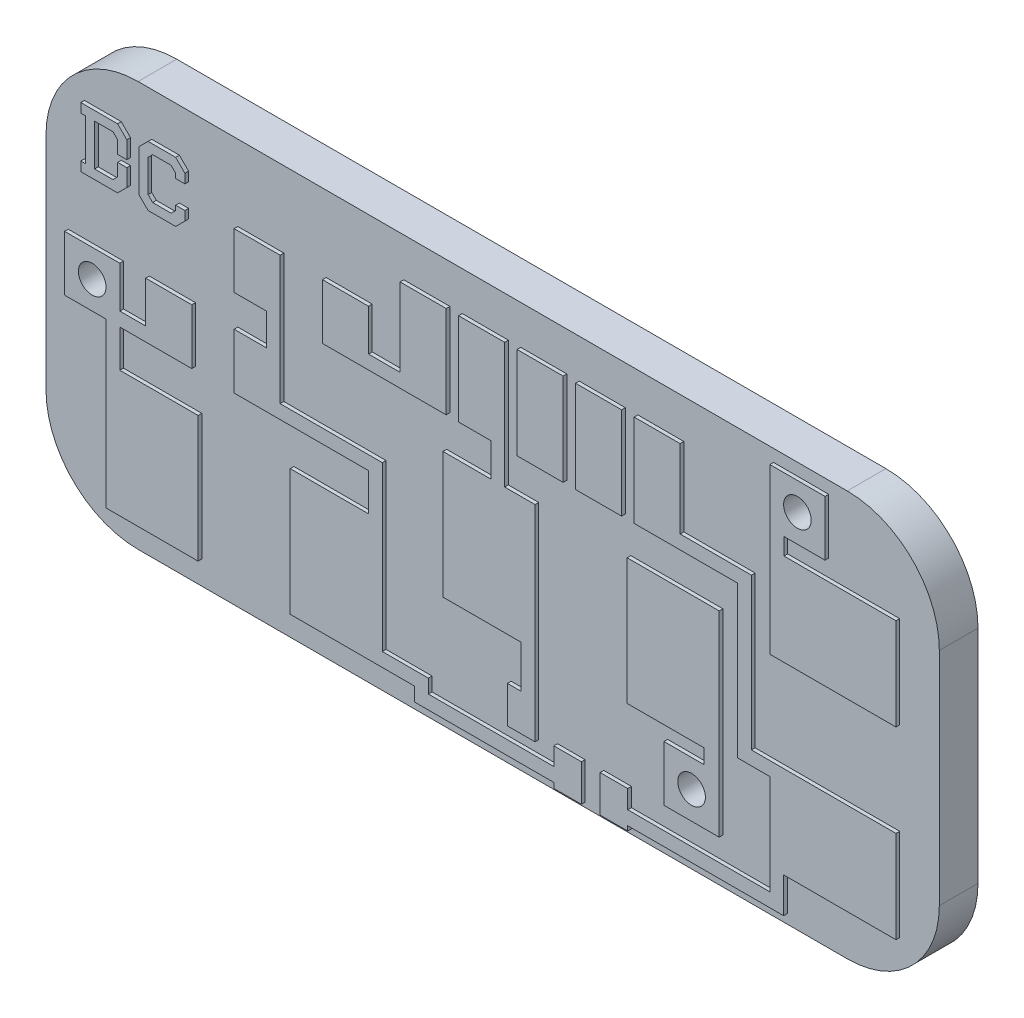
from build123d import *

# Parameters (mm, degrees)
SKETCH1_W            = 9.7
SKETCH1_H            = 4.4
BOSS_EXTRUDE1_DEPTH  = 0.42
FILLET1_R            = 1
FILLET2_R            = 1
FILLET3_R            = 1
FILLET4_R            = 1
BOSS_EXTRUDE2_DEPTH  = 0.04
BOSS_EXTRUDE3_DEPTH  = 0.04
BOSS_EXTRUDE4_DEPTH  = 0.04
BOSS_EXTRUDE5_DEPTH  = 0.04
BOSS_EXTRUDE6_DEPTH  = 0.04
BOSS_EXTRUDE7_DEPTH  = 0.04
BOSS_EXTRUDE8_DEPTH  = 0.04
BOSS_EXTRUDE9_DEPTH  = 0.04
BOSS_EXTRUDE10_DEPTH = 0.04
SKETCH11_W           = 0.5
SKETCH11_H           = 1
BOSS_EXTRUDE11_DEPTH = 0.04
SKETCH12_W           = 0.5
SKETCH12_H           = 1
BOSS_EXTRUDE12_DEPTH = 0.04
BOSS_EXTRUDE13_DEPTH = 0.025
HOLE1_D              = 0.3
HOLE2_D              = 0.3
HOLE3_D              = 0.3
CHAMFER1_SIZE        = 0.1
CHAMFER2_SIZE        = 0.05
CHAMFER3_SIZE        = 0.1
CHAMFER4_SIZE        = 0.05
CHAMFER5_SIZE        = 0.1
CHAMFER6_SIZE        = 0.1
CHAMFER7_SIZE        = 0.05
CHAMFER8_SIZE        = 0.05


with BuildPart() as part:
    # Sketch1 → Boss-Extrude1 (new body)
    with BuildSketch(Plane.XY):
        with Locations((4.849999999, 2.20000002)):
            Rectangle(SKETCH1_W, SKETCH1_H)
    extrude(amount=-BOSS_EXTRUDE1_DEPTH)

    # Fillet1
    fillet1_edges = [part.edges().sort_by_distance(p)[0] for p in [
        (-1e-09, 2e-08, -0.21),
    ]]
    fillet(fillet1_edges, radius=FILLET1_R)

    # Fillet2
    fillet2_edges = [part.edges().sort_by_distance(p)[0] for p in [
        (-1e-09, 4.40000002, -0.21),
    ]]
    fillet(fillet2_edges, radius=FILLET2_R)

    # Fillet3
    fillet3_edges = [part.edges().sort_by_distance(p)[0] for p in [
        (9.699999999, 2e-08, -0.21),
    ]]
    fillet(fillet3_edges, radius=FILLET3_R)

    # Fillet4
    fillet4_edges = [part.edges().sort_by_distance(p)[0] for p in [
        (9.699999999, 4.40000002, -0.21),
    ]]
    fillet(fillet4_edges, radius=FILLET4_R)

    # Sketch2 → Boss-Extrude2 (add)
    with BuildSketch(Plane.XY):
        Polygon((3.691646515, 0.405675456), (4.19162877, 0.405675456), (4.19162877, 0.255675455), (5.553515055, 0.255675455), (5.553515055, 0.45000002), (5.853515055, 0.45000002), (5.853515055, 0.05000002), (5.553515055, 0.05000002), (5.553515055, 0.105675455), (4.04162877, 0.105675455), (4.04162877, 0.255675455), (2.69162877, 0.255675455), (2.69162877, 1.625675455), (3.54162877, 1.625675455), (3.54162877, 2.031926109), (2.082430938, 2.031926109), (2.082430938, 2.631926109), (2.432448683, 2.631926109), (2.432448683, 2.97790002), (2.082448683, 2.97790002), (2.082448683, 3.57790002), (2.582448683, 3.57790002), (2.582448683, 2.181926109), (3.691646515, 2.181926109), align=None)
    extrude(amount=BOSS_EXTRUDE2_DEPTH)

    # Sketch3 → Boss-Extrude3 (add)
    with BuildSketch(Plane.XY):
        Polygon((6.356700213, 0.05000002), (6.056700213, 0.05000002), (6.056700213, 0.45000002), (6.356700213, 0.45000002), (6.356700213, 0.25000002), (7.899307242, 0.25000002), (7.899307242, 1.334176783), (7.549307242, 1.334176783), (7.549307242, 2.97790002), (6.425655767, 2.97790002), (6.425655767, 3.97790002), (6.925655767, 3.97790002), (6.925655767, 3.12790002), (7.699307242, 3.12790002), (7.699307242, 1.484176783), (9.269307242, 1.484176783), (9.269307242, 0.484176783), (8.049307242, 0.484176783), (8.049307242, 0.10000002), (6.356700213, 0.10000002), align=None)
    extrude(amount=BOSS_EXTRUDE3_DEPTH)

    # Sketch4 → Boss-Extrude4 (add)
    with BuildSketch(Plane.XY):
        Polygon((1.148250377, 3.831121862), (1.148250377, 3.381121862), (1.398250377, 3.381121862), (1.448250377, 3.431121862), (1.448250377, 3.481121862), (1.548250377, 3.481121862), (1.548250377, 3.381121862), (1.448250377, 3.281121862), (1.048250377, 3.281121862), (1.048250377, 3.931121862), (1.448250377, 3.931121862), (1.548250377, 3.831121862), (1.548250377, 3.731121862), (1.448250377, 3.731121862), (1.448250377, 3.781121862), (1.398250377, 3.831121862), align=None)
    extrude(amount=BOSS_EXTRUDE4_DEPTH)

    # Sketch5 → Boss-Extrude5 (add)
    with BuildSketch(Plane.XY):
        Polygon((0.417468966, 3.281121862), (0.417468966, 3.381121862), (0.467468966, 3.381121862), (0.467468966, 3.831121862), (0.417468966, 3.831121862), (0.417468966, 3.931121862), (0.917468966, 3.931121862), (0.917468966, 3.643621862), (0.817468966, 3.643621862), (0.817468966, 3.831121862), (0.567468966, 3.831121862), (0.567468966, 3.381121862), (0.817468966, 3.381121862), (0.817468966, 3.568621862), (0.917468966, 3.568621862), (0.917468966, 3.281121862), align=None)
    extrude(amount=BOSS_EXTRUDE5_DEPTH)

    # Sketch6 → Boss-Extrude6 (add)
    with BuildSketch(Plane.XY):
        Polygon((5.349999999, 0.385416863), (5.049999999, 0.385416863), (5.049999999, 0.785416863), (5.199999999, 0.785416863), (5.199999999, 1.246726542), (4.349999999, 1.246726542), (4.349999999, 2.616726542), (4.869837207, 2.616726542), (4.869837207, 2.97790002), (4.519837207, 2.97790002), (4.519837207, 3.97790002), (5.019837207, 3.97790002), (5.019837207, 2.616726542), (5.349999999, 2.616726542), align=None)
    extrude(amount=BOSS_EXTRUDE6_DEPTH)

    # Sketch7 → Boss-Extrude7 (add)
    with BuildSketch(Plane.XY):
        Polygon((1.691646515, 1.625675456), (1.691646515, 0.255675456), (0.691646515, 0.255675456), (0.691646515, 2.031926109), (0.241646515, 2.031926109), (0.241646515, 2.631926109), (0.841646515, 2.631926109), (0.841646515, 2.181926109), (1.122933895, 2.181926109), (1.122933895, 2.631926109), (1.622933895, 2.631926109), (1.622933895, 2.031926109), (0.841646515, 2.031926109), (0.841646515, 1.625675456), align=None)
    extrude(amount=BOSS_EXTRUDE7_DEPTH)

    # Sketch8 → Boss-Extrude8 (add)
    with BuildSketch(Plane.XY):
        Polygon((3.54196347, 3.57790002), (3.54196347, 3.12790002), (3.884837207, 3.12790002), (3.884837207, 3.97790002), (4.384819462, 3.97790002), (4.384819462, 2.97790002), (3.041945725, 2.97790002), (3.041945725, 3.57790002), align=None)
    extrude(amount=BOSS_EXTRUDE8_DEPTH)

    # Sketch9 → Boss-Extrude9 (add)
    with BuildSketch(Plane.XY):
        Polygon((6.749999999, 1.088728228), (7.183722976, 1.088728228), (7.183722976, 1.246726542), (6.349999999, 1.246726542), (6.349999999, 2.616726542), (7.349999999, 2.616726542), (7.349999999, 0.488728228), (6.749999999, 0.488728228), align=None)
    extrude(amount=BOSS_EXTRUDE9_DEPTH)

    # Sketch10 → Boss-Extrude10 (add)
    with BuildSketch(Plane.XY):
        Polygon((8.499307242, 3.667992872), (8.053251319, 3.667992872), (8.053251319, 3.484176783), (9.269307242, 3.484176783), (9.269307242, 2.484176783), (7.899307242, 2.484176783), (7.899307242, 4.267992872), (8.499307242, 4.267992872), align=None)
    extrude(amount=BOSS_EXTRUDE10_DEPTH)

    # Sketch11 → Boss-Extrude11 (add)
    with BuildSketch(Plane.XY):
        with Locations((5.404837207, 3.47790002)):
            Rectangle(SKETCH11_W, SKETCH11_H)
    extrude(amount=BOSS_EXTRUDE11_DEPTH)

    # Sketch12 → Boss-Extrude12 (add)
    with BuildSketch(Plane.XY):
        with Locations((6.040655767, 3.47790002)):
            Rectangle(SKETCH12_W, SKETCH12_H)
    extrude(amount=BOSS_EXTRUDE12_DEPTH)

    # Sketch19 → Boss-Extrude13 (add)
    with BuildSketch(Plane(origin=(0, 0, -0.42), x_dir=(-1, 0, 0), z_dir=(0, 0, -1))):
        with BuildLine():
            Line((-0.999999999, 4.30000002), (-8.699999999, 4.30000002))
            ThreePointArc((-8.699999999, 4.30000002), (-9.336396102, 4.036396123), (-9.599999999, 3.40000002))
            Line((-9.599999999, 3.40000002), (-9.599999999, 1.00000002))
            ThreePointArc((-9.599999999, 1.00000002), (-9.336396102, 0.363603917), (-8.699999999, 0.10000002))
            Line((-8.699999999, 0.10000002), (-0.999999999, 0.10000002))
            ThreePointArc((-0.999999999, 0.10000002), (-0.363603896, 0.363603917), (-0.099999999, 1.00000002))
            Line((-0.099999999, 1.00000002), (-0.099999999, 3.40000002))
            ThreePointArc((-0.099999999, 3.40000002), (-0.363603896, 4.036396123), (-0.999999999, 4.30000002))
        make_face()
    extrude(amount=BOSS_EXTRUDE13_DEPTH)

    # Hole1 (through all)
    with Locations(Plane.XY.offset(0.04)):
        with Locations((8.199307242, 3.967992872)):
            Hole(HOLE1_D / 2)

    # Hole2 (through all)
    with Locations(Plane.XY.offset(0.04)):
        with Locations((7.049999999, 0.788728228)):
            Hole(HOLE2_D / 2)

    # Hole3 (through all)
    with Locations(Plane.XY.offset(0.04)):
        with Locations((0.541646515, 2.331926109)):
            Hole(HOLE3_D / 2)

    # Chamfer1
    chamfer1_edges = [part.edges().sort_by_distance(p)[0] for p in [
        (0.917468966, 3.931121862, 0.02),
    ]]
    chamfer(chamfer1_edges, length=CHAMFER1_SIZE)

    # Chamfer2
    chamfer2_edges = [part.edges().sort_by_distance(p)[0] for p in [
        (1.148250377, 3.831121862, 0.02),
    ]]
    chamfer(chamfer2_edges, length=CHAMFER2_SIZE)

    # Chamfer3
    chamfer3_edges = [part.edges().sort_by_distance(p)[0] for p in [
        (0.917468966, 3.281121862, 0.02),
    ]]
    chamfer(chamfer3_edges, length=CHAMFER3_SIZE)

    # Chamfer4
    chamfer4_edges = [part.edges().sort_by_distance(p)[0] for p in [
        (0.817468966, 3.831121862, 0.02),
    ]]
    chamfer(chamfer4_edges, length=CHAMFER4_SIZE)

    # Chamfer5
    chamfer5_edges = [part.edges().sort_by_distance(p)[0] for p in [
        (1.048250377, 3.281121862, 0.02),
    ]]
    chamfer(chamfer5_edges, length=CHAMFER5_SIZE)

    # Chamfer6
    chamfer6_edges = [part.edges().sort_by_distance(p)[0] for p in [
        (1.048250377, 3.931121862, 0.02),
    ]]
    chamfer(chamfer6_edges, length=CHAMFER6_SIZE)

    # Chamfer7
    chamfer7_edges = [part.edges().sort_by_distance(p)[0] for p in [
        (1.148250377, 3.381121862, 0.02),
    ]]
    chamfer(chamfer7_edges, length=CHAMFER7_SIZE)

    # Chamfer8
    chamfer8_edges = [part.edges().sort_by_distance(p)[0] for p in [
        (0.817468966, 3.381121862, 0.02),
    ]]
    chamfer(chamfer8_edges, length=CHAMFER8_SIZE)


solid = part.part
